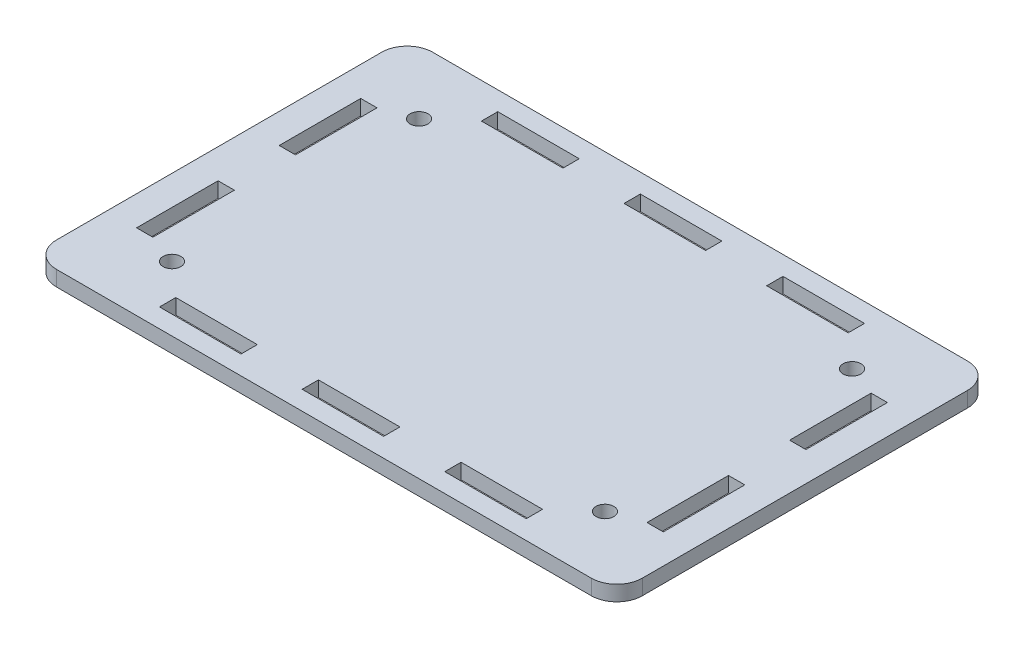
from build123d import *

# Parameters (mm, degrees)
SKETCH1_W           = 115
SKETCH1_H           = 73.849129594
SKETCH1_R           = 1.75
SKETCH1_W_2         = 16
SKETCH1_H_2         = 3.2
SKETCH1_W_3         = 3.2
SKETCH1_H_3         = 16
BOSS_EXTRUDE1_DEPTH = 3
FILLET1_R           = 5


with BuildPart() as part:
    # Sketch1 → Boss-Extrude1 (new body)
    with BuildSketch(Plane(origin=(0, 0, 0), x_dir=(1, 0, 0), z_dir=(0, 1, 0))):
        Rectangle(SKETCH1_W, SKETCH1_H)
        with Locations(Location((-42.5, 24.25, 0), (0, 0, 270))):
            Circle(SKETCH1_R, mode=Mode.SUBTRACT)
        with Locations(Location((42.5, 24.25, 0), (0, 0, 270))):
            Circle(SKETCH1_R, mode=Mode.SUBTRACT)
        with Locations(Location((-42.5, -24.25, 0), (0, 0, 270))):
            Circle(SKETCH1_R, mode=Mode.SUBTRACT)
        with Locations(Location((42.5, -24.25, 0), (0, 0, 270))):
            Circle(SKETCH1_R, mode=Mode.SUBTRACT)
        with Locations((-28, 31.6)):
            Rectangle(SKETCH1_W_2, SKETCH1_H_2, mode=Mode.SUBTRACT)
        with Locations((28, 31.6)):
            Rectangle(SKETCH1_W_2, SKETCH1_H_2, mode=Mode.SUBTRACT)
        with Locations((-50.1, 14)):
            Rectangle(SKETCH1_W_3, SKETCH1_H_3, mode=Mode.SUBTRACT)
        with Locations((-50.1, -14)):
            Rectangle(SKETCH1_W_3, SKETCH1_H_3, mode=Mode.SUBTRACT)
        with Locations((0, 31.6)):
            Rectangle(SKETCH1_W_2, SKETCH1_H_2, mode=Mode.SUBTRACT)
        with Locations((-28, -31.6)):
            Rectangle(SKETCH1_W_2, SKETCH1_H_2, mode=Mode.SUBTRACT)
        with Locations((28, -31.6)):
            Rectangle(SKETCH1_W_2, SKETCH1_H_2, mode=Mode.SUBTRACT)
        with Locations((0, -31.6)):
            Rectangle(SKETCH1_W_2, SKETCH1_H_2, mode=Mode.SUBTRACT)
        with Locations((50.1, -14)):
            Rectangle(SKETCH1_W_3, SKETCH1_H_3, mode=Mode.SUBTRACT)
        with Locations((50.1, 14)):
            Rectangle(SKETCH1_W_3, SKETCH1_H_3, mode=Mode.SUBTRACT)
    extrude(amount=BOSS_EXTRUDE1_DEPTH)

    # Fillet1
    fillet1_edges = [part.edges().sort_by_distance(p)[0] for p in [
        (57.5, 1.5, 36.924564797),
        (-57.5, 1.5, 36.924564797),
        (-57.5, 1.5, -36.924564797),
        (57.5, 1.5, -36.924564797),
    ]]
    fillet(fillet1_edges, radius=FILLET1_R)


solid = part.part
